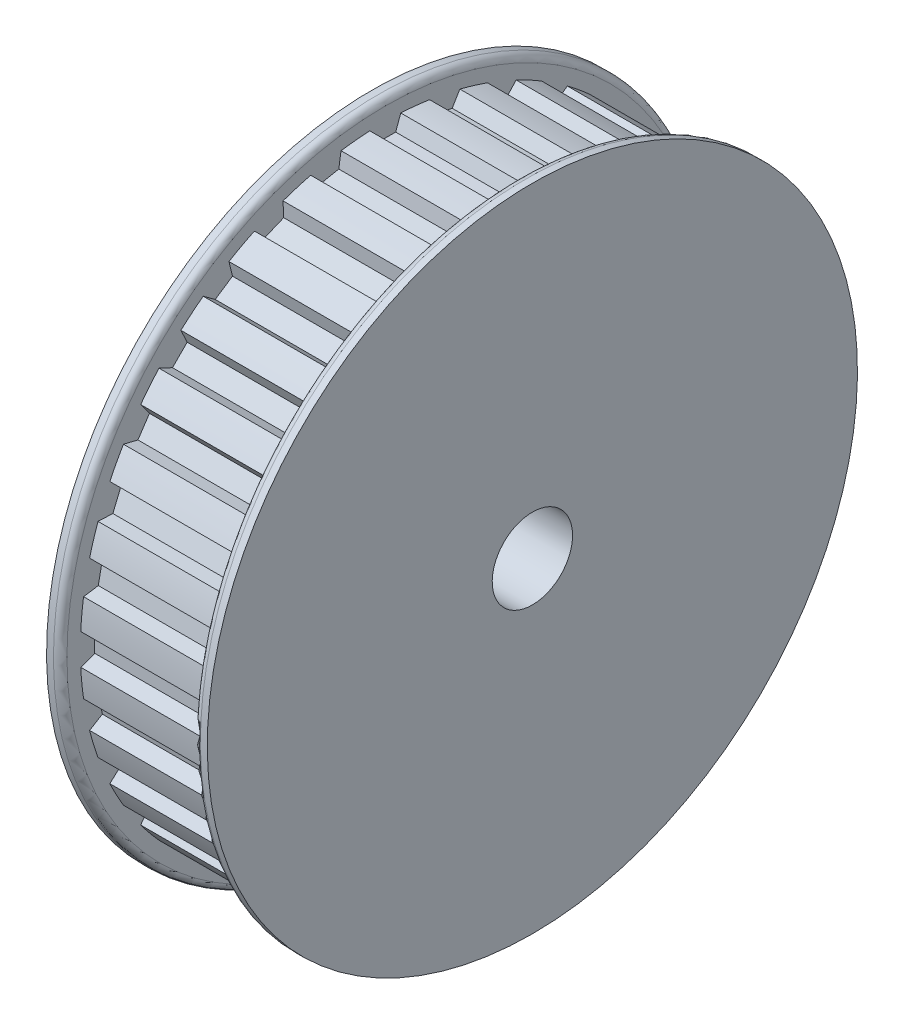
from build123d import *

# Parameters (mm, degrees)
SKETCH4_R          = 48.514
SKETCH4_R_2        = 48.174402
CUT_EXTRUDE2_DEPTH = 21.082
CUT_EXTRUDE1_DEPTH = 21.082
CIRPATTERN1_COUNT  = 32
SKETCH6_R          = 3.175
CUT_EXTRUDE3_DEPTH = 76.088981851
CUT_EXTRUDE4_DEPTH = 2.032
CIRPATTERN2_COUNT  = 2
CIRPATTERN2_ANGLE  = 90
CIRPATTERN3_COUNT  = 2
CIRPATTERN3_ANGLE  = 90


with BuildPart() as part:
    # Sketch1 → Revolve1 (revolve)
    with BuildSketch(Plane.XY, mode=Mode.PRIVATE) as revolve1_sk:
        with BuildLine():
            Line((-19.05, 6.35), (19.05, 6.35))
            Line((19.05, 6.35), (19.05, 51.3588))
            Line((19.05, 51.3588), (17.9578, 51.3588))
            ThreePointArc((17.9578, 51.3588), (17.203458486, 51.046341514), (16.891, 50.292))
            Line((16.891, 50.292), (16.891, 48.514))
            Line((16.891, 48.514), (-4.191, 48.514))
            Line((-4.191, 48.514), (-4.191, 50.292))
            ThreePointArc((-4.191, 50.292), (-4.503458486, 51.046341514), (-5.2578, 51.3588))
            Line((-5.2578, 51.3588), (-6.35, 51.3588))
            Line((-6.35, 51.3588), (-6.35, 33.3375))
            Line((-6.35, 33.3375), (-19.05, 33.3375))
            Line((-19.05, 33.3375), (-19.05, 6.35))
        make_face()
    revolve(revolve1_sk.sketch.rotate(Axis((-19.05, 0, 0), (1, 0, 0)), 180), axis=Axis((-19.05, 0, 0), (1, 0, 0)))

    # Sketch4 → Cut-Extrude2 (cut)
    with BuildSketch(Plane(origin=(-4.191, 0, 0), x_dir=(0, 0, -1), z_dir=(1, 0, 0))):
        Circle(SKETCH4_R)
        with Locations(Location((0, 0, 0), (0, 0, 90))):
            Circle(SKETCH4_R_2, mode=Mode.SUBTRACT)
    extrude(amount=CUT_EXTRUDE2_DEPTH, mode=Mode.SUBTRACT)

    # Sketch3 → Cut-Extrude1 (cut)
    with BuildSketch(Plane(origin=(-4.191, 0, 0), x_dir=(0, 0, -1), z_dir=(1, 0, 0))):
        with BuildLine():
            Line((-2.445655751, 48.112283006), (-1.640629911, 45.900492688))
            Line((-1.640629911, 45.900492688), (1.640629911, 45.900492688))
            Line((1.640629911, 45.900492688), (2.445655751, 48.112283006))
            ThreePointArc((2.445655751, 48.112283006), (0, 48.174402), (-2.445655751, 48.112283006))
        make_face()
    cut_extrude1 = extrude(amount=CUT_EXTRUDE1_DEPTH, mode=Mode.SUBTRACT)

    # CirPattern1: Cut-Extrude1 ×32 about axis
    cirpattern1_axis = Axis((0, 0, 0), (1, 0, 0))
    for i in range(1, CIRPATTERN1_COUNT):
        add(cut_extrude1.rotate(cirpattern1_axis, i * 360 / CIRPATTERN1_COUNT), mode=Mode.SUBTRACT)

    # Sketch6 → Cut-Extrude3 (cut, through all)
    with BuildSketch(Plane(origin=(0, 0, 0), x_dir=(1, 0, 0), z_dir=(0, 1, 0))):
        with Locations(Location((-12.7, 0, 0), (0, 0, 90))):
            Circle(SKETCH6_R)
    cut_extrude3 = extrude(amount=CUT_EXTRUDE3_DEPTH, mode=Mode.SUBTRACT)

    # CirPattern2: Cut-Extrude3 ×2 about axis
    cirpattern2_axis = Axis((-19.05, 0, 0), (1, 0, 0))
    for i in range(1, CIRPATTERN2_COUNT):
        add(cut_extrude3.rotate(cirpattern2_axis, i * CIRPATTERN2_ANGLE / (CIRPATTERN2_COUNT - 1)), mode=Mode.SUBTRACT)


with BuildPart() as body_2:
    # Sketch7 → Revolve2 (revolve)
    with BuildSketch(Plane.XY, mode=Mode.PRIVATE) as revolve2_sk:
        Polygon((-15.621, 33.3375), (-12.7, 33.3375), (-12.7, 6.731), (-15.621, 6.731), (-15.875, 6.985), (-15.875, 33.0835), align=None)
    revolve(revolve2_sk.sketch.rotate(Axis((-12.7, 6.731, 0), (0, 1, 0)), 180), axis=Axis((-12.7, 6.731, 0), (0, 1, 0)))

    # Sketch8 → Cut-Extrude4 (cut)
    with BuildSketch(Plane(origin=(0, 33.3375, 0), x_dir=(1, 0, 0), z_dir=(0, 1, 0))):
        Polygon((-12.7, 1.833087105), (-14.2875, 0.916543552), (-14.2875, -0.916543552), (-12.7, -1.833087105), (-11.1125, -0.916543552), (-11.1125, 0.916543552), align=None)
    extrude(amount=-CUT_EXTRUDE4_DEPTH, mode=Mode.SUBTRACT)


with BuildPart() as cirpattern3_1:
    # CirPattern3: pattern copy
    add(body_2.part.rotate(Axis((0, 0, 0), (1, 0, 0)), 1 * CIRPATTERN3_ANGLE / (CIRPATTERN3_COUNT - 1)))


solid = Compound([part.part, body_2.part, cirpattern3_1.part])
